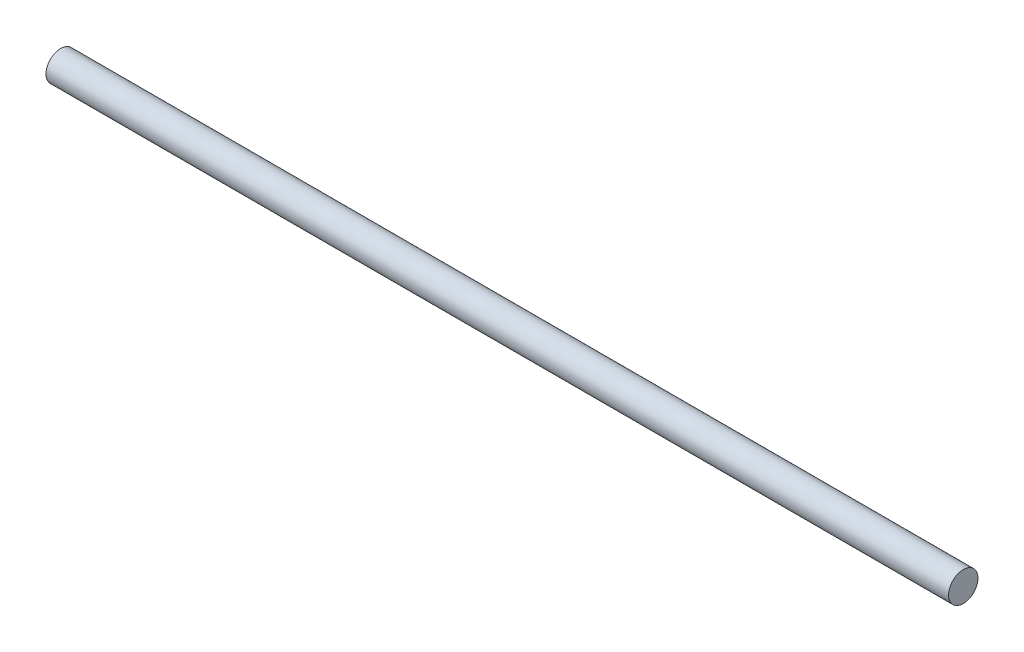
from build123d import *

# Parameters (mm, degrees)
SKETCH1_R           = 45
BOSS_EXTRUDE1_DEPTH = 2760


with BuildPart() as part:
    # Sketch1 → Boss-Extrude1 (new body)
    with BuildSketch(Plane(origin=(0, 0, 0), x_dir=(0, 0, -1), z_dir=(1, 0, 0))):
        Circle(SKETCH1_R)
    extrude(amount=BOSS_EXTRUDE1_DEPTH)


solid = part.part
